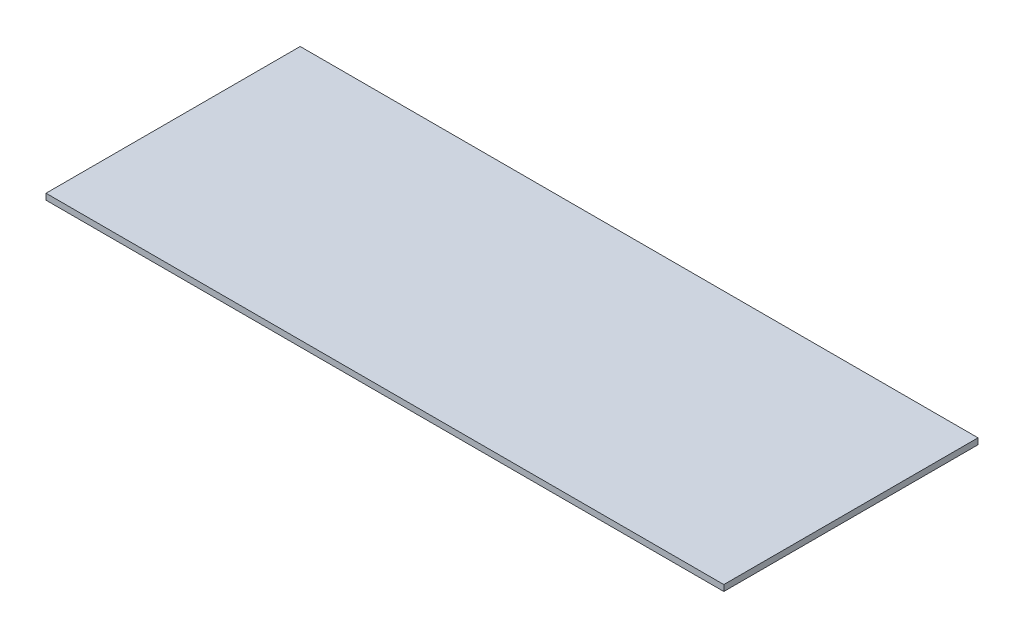
from build123d import *

# Parameters (mm, degrees)
SKETCH1_W           = 355.6
SKETCH1_H           = 133.35
BOSS_EXTRUDE1_DEPTH = 1.5875


with BuildPart() as part:
    # Sketch1 → Boss-Extrude1 (new, symmetric)
    with BuildSketch(Plane(origin=(0, 0, 0), x_dir=(1, 0, 0), z_dir=(0, 1, 0))):
        Rectangle(SKETCH1_W, SKETCH1_H)
    extrude(amount=BOSS_EXTRUDE1_DEPTH, both=True)


solid = part.part
